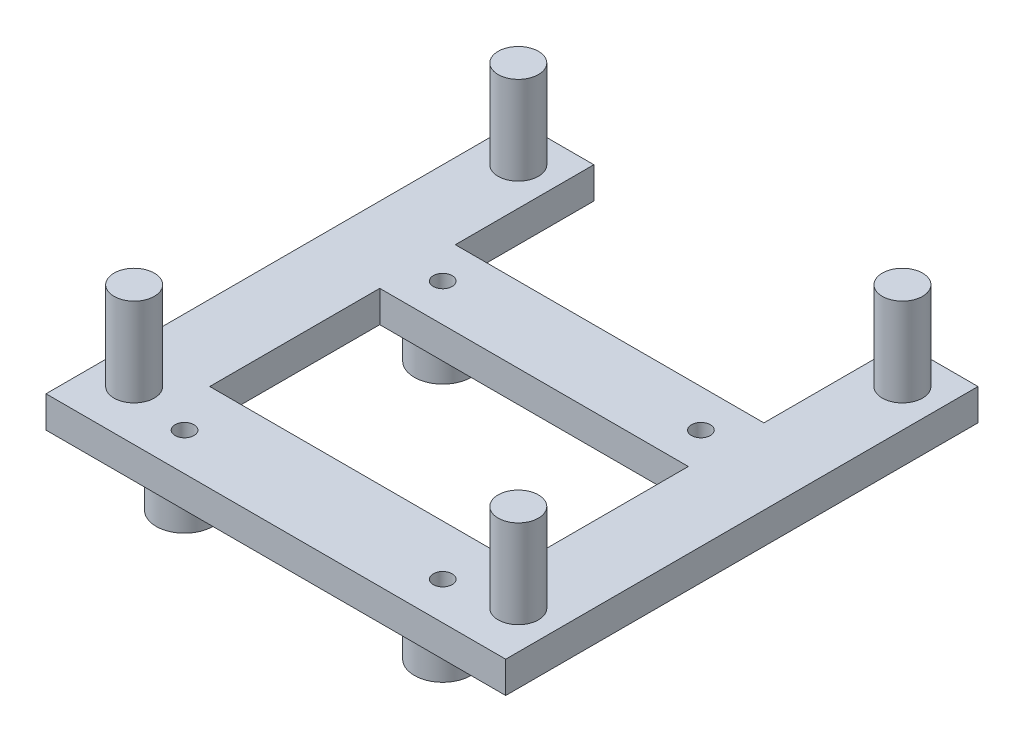
from build123d import *

# Parameters (mm, degrees)
SKETCH1_R             = 1.6
BOSS_EXTRUDE1_DEPTH   = 7
BOSS_EXTRUDE1_2_DEPTH = 7
BOSS_EXTRUDE1_3_DEPTH = 7
BOSS_EXTRUDE1_4_DEPTH = 7
BOSS_EXTRUDE2_DEPTH   = 2.5
SKETCH3_R             = 2.25
SKETCH3_R_2           = 0.75
BOSS_EXTRUDE3_DEPTH   = 3
SKETCH4_W             = 24.5
SKETCH4_H             = 6
BOSS_EXTRUDE4_DEPTH   = 2.5
CUT_EXTRUDE1_START    = -10
SKETCH5_R             = 0.75
CUT_EXTRUDE1_DEPTH    = 10


with BuildPart() as part:
    # Sketch1 → Boss-Extrude1 (new body)
    with BuildSketch(Plane(origin=(0, 0, 0), x_dir=(1, 0, 0), z_dir=(0, 1, 0))):
        with Locations(Location((-15.25, -15.25, 0), (0, 0, 270))):
            Circle(SKETCH1_R)
    extrude(amount=BOSS_EXTRUDE1_DEPTH)



with BuildPart() as body_2:
    # Sketch1 → Boss-Extrude1 2 (new body)
    with BuildSketch(Plane(origin=(0, 0, 0), x_dir=(1, 0, 0), z_dir=(0, 1, 0))):
        with Locations(Location((-15.25, 15.25, 0), (0, 0, 270))):
            Circle(SKETCH1_R)
    extrude(amount=BOSS_EXTRUDE1_2_DEPTH)


with BuildPart() as body_3:
    # Sketch1 → Boss-Extrude1 3 (new body)
    with BuildSketch(Plane(origin=(0, 0, 0), x_dir=(1, 0, 0), z_dir=(0, 1, 0))):
        with Locations(Location((15.25, 15.25, 0), (0, 0, 270))):
            Circle(SKETCH1_R)
    extrude(amount=BOSS_EXTRUDE1_3_DEPTH)


with BuildPart() as body_4:
    # Sketch1 → Boss-Extrude1 4 (new body)
    with BuildSketch(Plane(origin=(0, 0, 0), x_dir=(1, 0, 0), z_dir=(0, 1, 0))):
        with Locations(Location((15.25, -15.25, 0), (0, 0, 270))):
            Circle(SKETCH1_R)
    extrude(amount=BOSS_EXTRUDE1_4_DEPTH)


with BuildPart() as part_1:
    add(part.part)

    add(body_2.part)  # Boss-Extrude2 merges body 2

    add(body_3.part)  # Boss-Extrude2 merges body 3

    add(body_4.part)  # Boss-Extrude2 merges body 4
    # Sketch2 → Boss-Extrude2 (add)
    with BuildSketch(Plane.XZ):
        Polygon((-12.25, 12.25), (12.25, 12.25), (12.25, -18.25), (18.25, -18.25), (18.25, 19.25), (-18.25, 19.25), (-18.25, -18.25), (-12.25, -18.25), align=None)
    extrude(amount=BOSS_EXTRUDE2_DEPTH)

    # Sketch3 → Boss-Extrude3 (add)
    # profile 1 of 4: a face of its own
    with BuildSketch(Plane.XZ.offset(2.5)):
        with Locations(Location((-10.25, 16.25, 0), (0, 0, 90))):
            Circle(SKETCH3_R)
        with Locations(Location((-10.25, 16.25, 0), (0, 0, 270))):
            Circle(SKETCH3_R_2, mode=Mode.SUBTRACT)
    # profile 2 of 4: a face of its own
    with BuildSketch(Plane.XZ.offset(2.5)):
        with Locations(Location((10.25, 16.25, 0), (0, 0, 90))):
            Circle(SKETCH3_R)
        with Locations(Location((10.25, 16.25, 0), (0, 0, 270))):
            Circle(SKETCH3_R_2, mode=Mode.SUBTRACT)
    # profile 3 of 4: a face of its own
    with BuildSketch(Plane.XZ.offset(2.5)):
        with Locations(Location((10.25, -4.25, 0), (0, 0, 27.266044451))):
            Circle(SKETCH3_R)
        with Locations(Location((10.25, -4.25, 0), (0, 0, 270))):
            Circle(SKETCH3_R_2, mode=Mode.SUBTRACT)
    # profile 4 of 4: a face of its own
    with BuildSketch(Plane.XZ.offset(2.5)):
        with Locations(Location((-10.25, -4.25, 0), (0, 0, 152.733955549))):
            Circle(SKETCH3_R)
        with Locations(Location((-10.25, -4.25, 0), (0, 0, 270))):
            Circle(SKETCH3_R_2, mode=Mode.SUBTRACT)
    extrude(amount=BOSS_EXTRUDE3_DEPTH)

    # Sketch4 → Boss-Extrude4 (add)
    with BuildSketch(Plane(origin=(0, -2.5, 0), x_dir=(1, 0, 0), z_dir=(0, 1, 0))):
        with Locations((0, 4.25)):
            Rectangle(SKETCH4_W, SKETCH4_H)
    extrude(amount=BOSS_EXTRUDE4_DEPTH)

    # Sketch5 → Cut-Extrude1 (cut)
    with BuildSketch(Plane.XZ.offset(2.5).offset(CUT_EXTRUDE1_START)):
        with Locations(Location((-10.25, 16.25, 0), (0, 0, 90))):
            Circle(SKETCH5_R)
        with Locations(Location((10.25, 16.25, 0), (0, 0, 90))):
            Circle(SKETCH5_R)
        with Locations(Location((10.25, -4.25, 0), (0, 0, 90))):
            Circle(SKETCH5_R)
        with Locations(Location((-10.25, -4.25, 0), (0, 0, 90))):
            Circle(SKETCH5_R)
    extrude(amount=CUT_EXTRUDE1_DEPTH, mode=Mode.SUBTRACT)


solid = part_1.part
